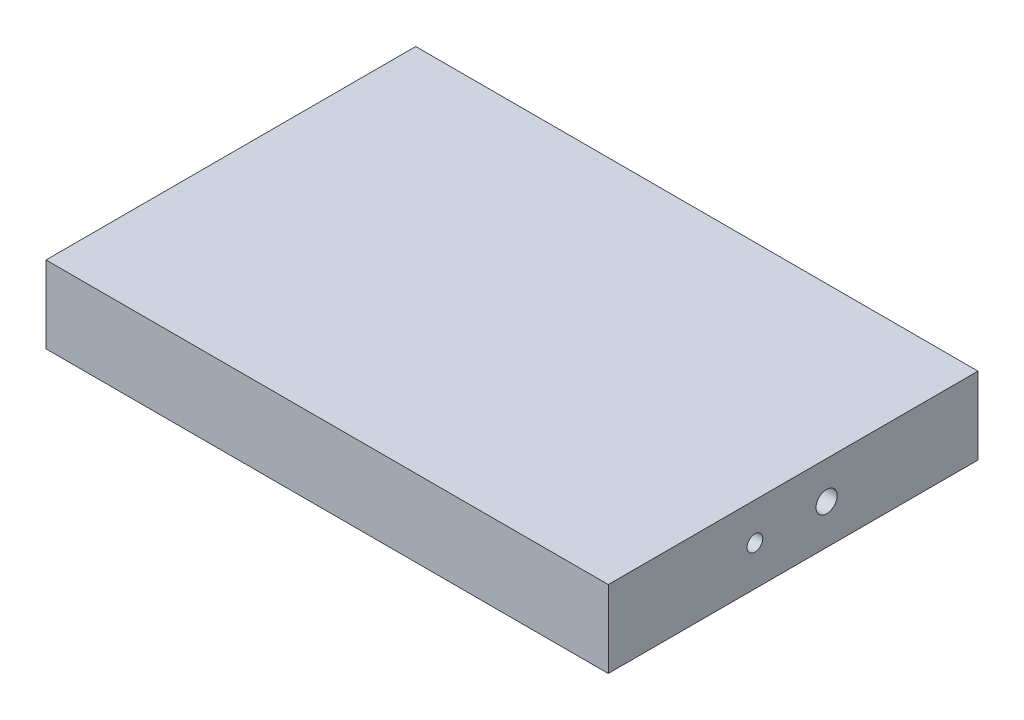
from build123d import *

# Parameters (mm, degrees)
SKETCH1_W           = 36.5
SKETCH1_H           = 24
BOSS_EXTRUDE1_DEPTH = 5
SKETCH2_R           = 0.511749617
SKETCH2_R_2         = 0.684048874
CUT_EXTRUDE1_DEPTH  = 5.5


with BuildPart() as part:
    # Sketch1 → Boss-Extrude1 (new body)
    with BuildSketch(Plane(origin=(0, 0, 0), x_dir=(1, 0, 0), z_dir=(0, 1, 0))):
        with Locations((18.25, 12)):
            Rectangle(SKETCH1_W, SKETCH1_H)
    extrude(amount=BOSS_EXTRUDE1_DEPTH)

    # Sketch2 → Cut-Extrude1 (cut)
    with BuildSketch(Plane(origin=(36.5, 0, 0), x_dir=(0, 0, -1), z_dir=(1, 0, 0))):
        with Locations((9.518217133, 2.579703957)):
            Circle(SKETCH2_R)
        with Locations((14.170102922, 2.579703957)):
            Circle(SKETCH2_R_2)
    extrude(amount=-CUT_EXTRUDE1_DEPTH, mode=Mode.SUBTRACT)


solid = part.part
